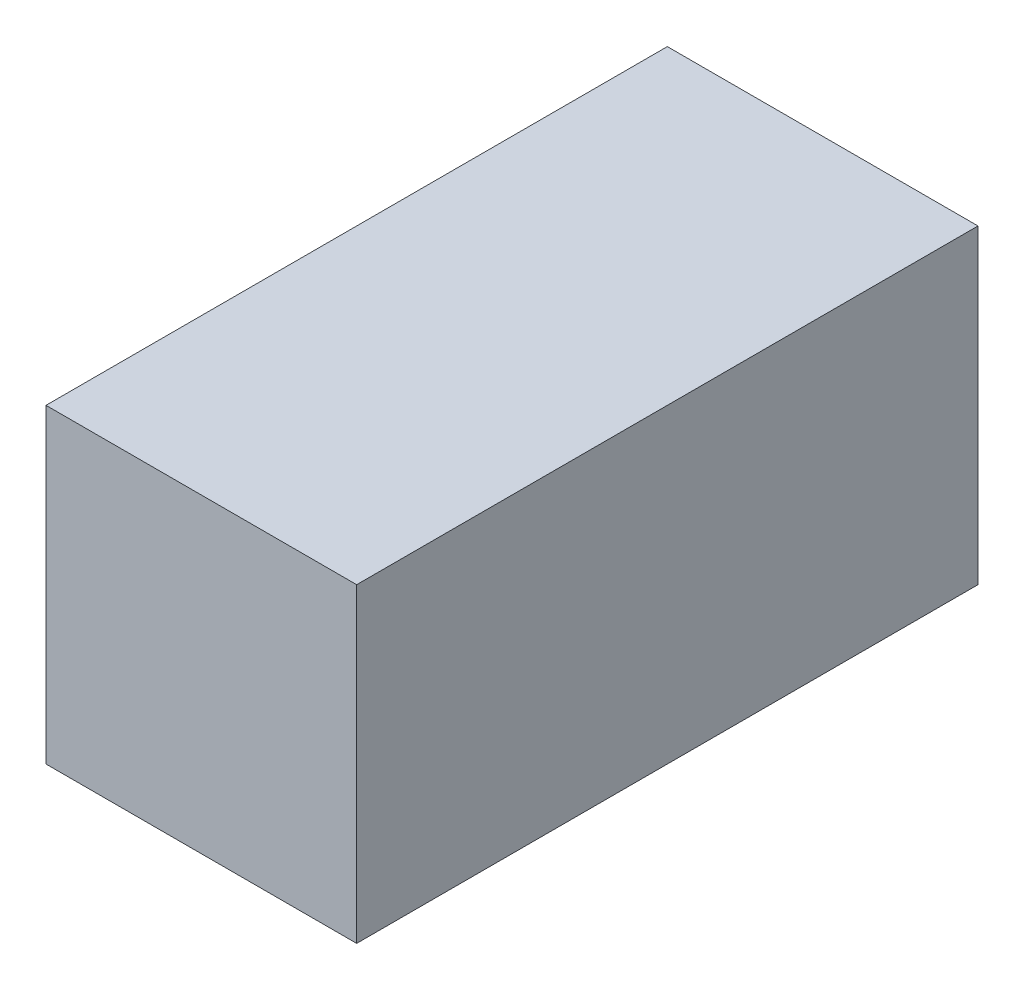
from build123d import *

# Parameters (mm, degrees)
SKETCH1_W           = 20
SKETCH1_H           = 20
BOSS_EXTRUDE1_DEPTH = 40
SKETCH2_R           = 5
CUT_EXTRUDE1_DEPTH  = 10


with BuildPart() as part:
    # Sketch1 → Boss-Extrude1 (new body)
    with BuildSketch(Plane.XY):
        with Locations((0.569105691, -2.256097561)):
            Rectangle(SKETCH1_W, SKETCH1_H)
    extrude(amount=BOSS_EXTRUDE1_DEPTH)

    # Sketch2 → Cut-Extrude1 (cut, symmetric)
    with BuildSketch(Plane(origin=(0, 0, 0), x_dir=(-1, 0, 0), z_dir=(0, 0, -1))):
        with Locations((-0.569105691, -2.256097561)):
            Circle(SKETCH2_R)
    extrude(amount=CUT_EXTRUDE1_DEPTH, both=True, mode=Mode.SUBTRACT)


solid = part.part
